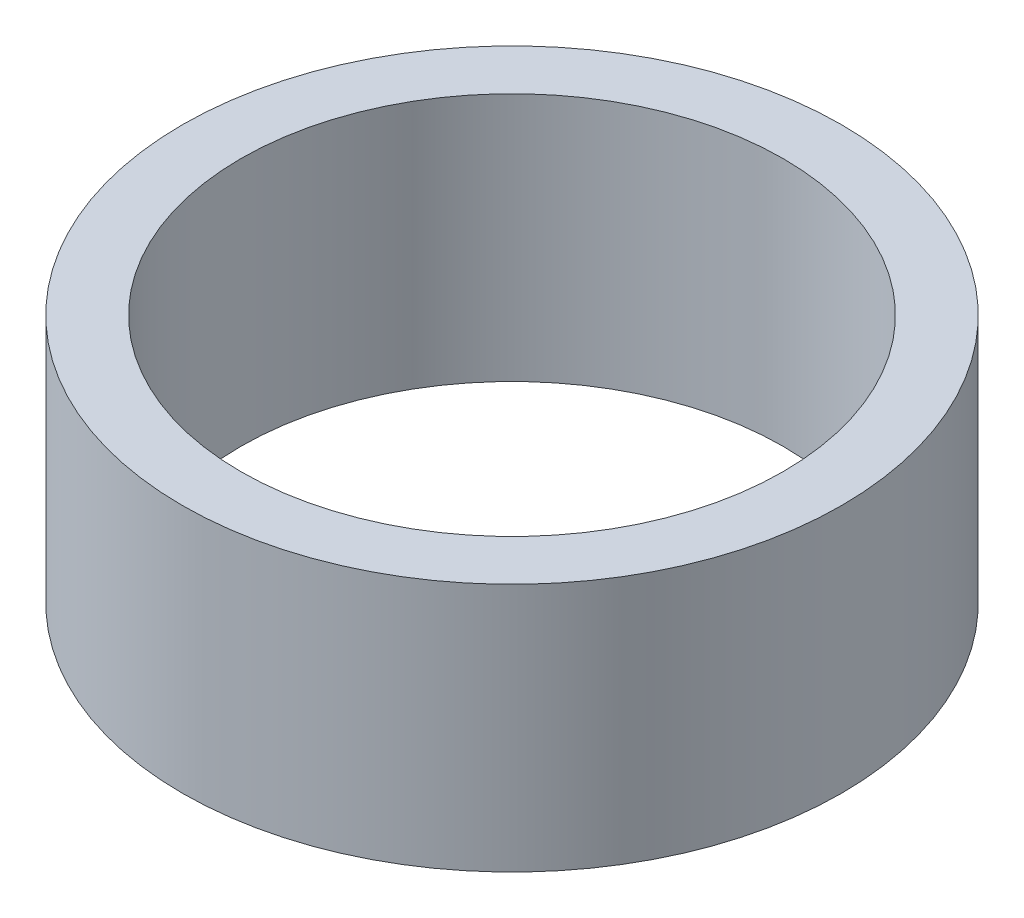
from build123d import *

# Parameters (mm, degrees)
SKETCH1_R           = 3.96875
SKETCH1_R_2         = 3.2639
BOSS_EXTRUDE1_DEPTH = 3


with BuildPart() as part:
    # Sketch1 → Boss-Extrude1 (new body)
    with BuildSketch(Plane(origin=(0, 0, 0), x_dir=(1, 0, 0), z_dir=(0, 1, 0))):
        with Locations(Location((0, 0, 0), (0, 0, 270))):
            Circle(SKETCH1_R)
        with Locations(Location((0, 0, 0), (0, 0, 270))):
            Circle(SKETCH1_R_2, mode=Mode.SUBTRACT)
    extrude(amount=BOSS_EXTRUDE1_DEPTH)


solid = part.part
